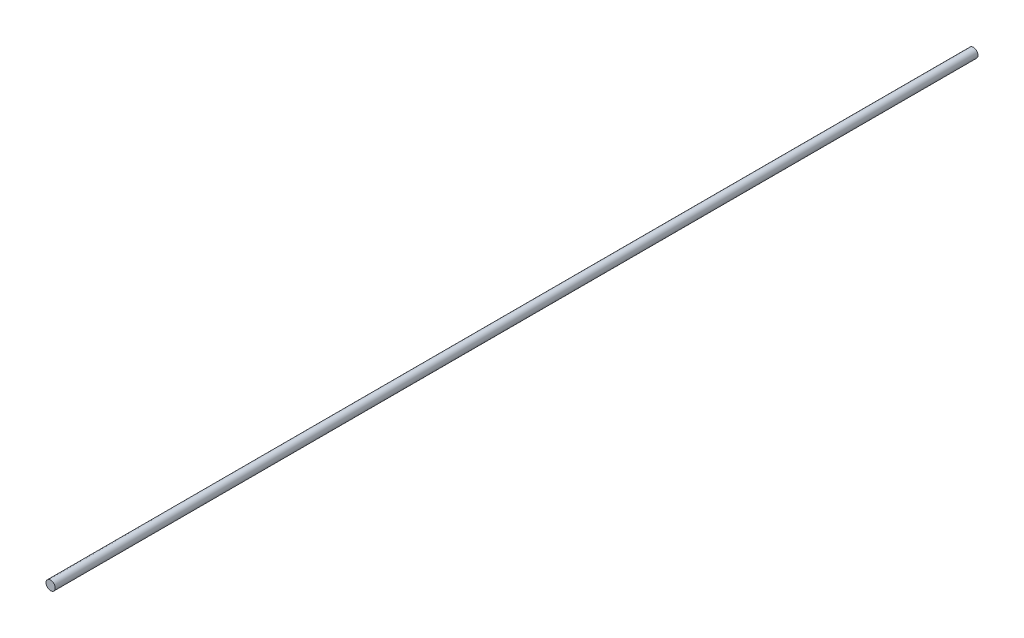
from build123d import *

# Parameters (mm, degrees)
SKETCH1_R           = 5
BOSS_EXTRUDE1_DEPTH = 1000


with BuildPart() as part:
    # Sketch1 → Boss-Extrude1 (new body)
    with BuildSketch(Plane.XY):
        Circle(SKETCH1_R)
    extrude(amount=BOSS_EXTRUDE1_DEPTH)


solid = part.part
